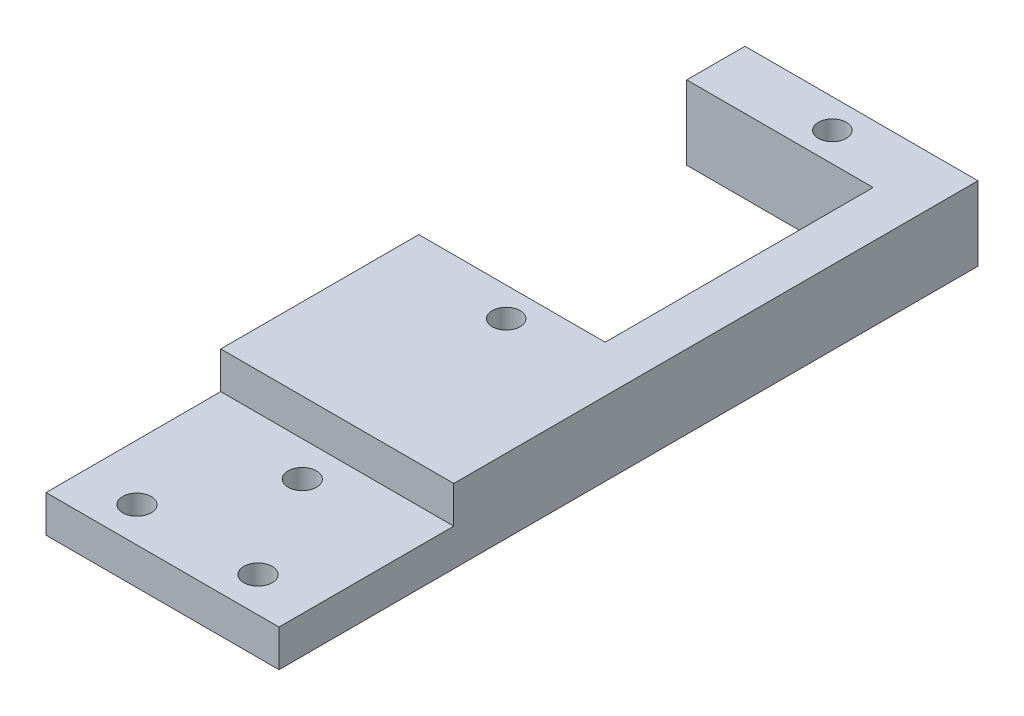
from build123d import *

# Parameters (mm, degrees)
SKETCH2_W                = 20
SKETCH2_H                = 60
BOSS_EXTRUDE1_DEPTH      = 6.35
SKETCH4_W                = 16
SKETCH4_H                = 23
CUT_EXTRUDE1_DEPTH       = 64.563531211
M2_CLEARANCE_HOLE1_D     = 2.4
M2_CLEARANCE_HOLE1_DEPTH = 5
M2_CLEARANCE_HOLE1_TIP   = 0.721032743
SKETCH10_W               = 15
SKETCH10_H               = 3.175
CUT_EXTRUDE2_DEPTH       = 64.563531211
F_2_CLEARANCE_HOLE1_D    = 2.4384


with BuildPart() as part:
    # Sketch2 → Boss-Extrude1 (new body)
    with BuildSketch(Plane(origin=(0, 0, 0), x_dir=(1, 0, 0), z_dir=(0, 1, 0))):
        with Locations((10, -30)):
            Rectangle(SKETCH2_W, SKETCH2_H)
    extrude(amount=BOSS_EXTRUDE1_DEPTH)

    # Sketch4 → Cut-Extrude1 (cut, through all)
    with BuildSketch(Plane(origin=(0, 6.35, 0), x_dir=(1, 0, 0), z_dir=(0, 1, 0))):
        with Locations((8, -16.5)):
            Rectangle(SKETCH4_W, SKETCH4_H)
    extrude(amount=-CUT_EXTRUDE1_DEPTH, mode=Mode.SUBTRACT)

    # M2 Clearance Hole1
    with Locations(Plane(origin=(0, 6.35, 0), x_dir=(1, 0, 0), z_dir=(0, 1, 0))):
        with Locations((10, -30.5), (10, -2.5)):
            Hole(M2_CLEARANCE_HOLE1_D / 2, depth=M2_CLEARANCE_HOLE1_DEPTH)
            with Locations((0, 0, -(M2_CLEARANCE_HOLE1_DEPTH + M2_CLEARANCE_HOLE1_TIP / 2))):  # 118° drill point
                Cone(0, M2_CLEARANCE_HOLE1_D / 2, M2_CLEARANCE_HOLE1_TIP, mode=Mode.SUBTRACT)

    # Sketch10 → Cut-Extrude2 (cut, through all)
    with BuildSketch(Plane(origin=(20, 0, 0), x_dir=(0, 0, -1), z_dir=(1, 0, 0))):
        with Locations((-52.5, 4.7625)):
            Rectangle(SKETCH10_W, SKETCH10_H)
    extrude(amount=-CUT_EXTRUDE2_DEPTH, mode=Mode.SUBTRACT)

    # #2 Clearance Hole1 (through all)
    with Locations(Plane(origin=(0, 3.175, 0), x_dir=(1, 0, 0), z_dir=(0, 1, 0))):
        with Locations((10, -48), (4.803847577, -57), (15.196152423, -57)):
            Hole(F_2_CLEARANCE_HOLE1_D / 2)


solid = part.part
